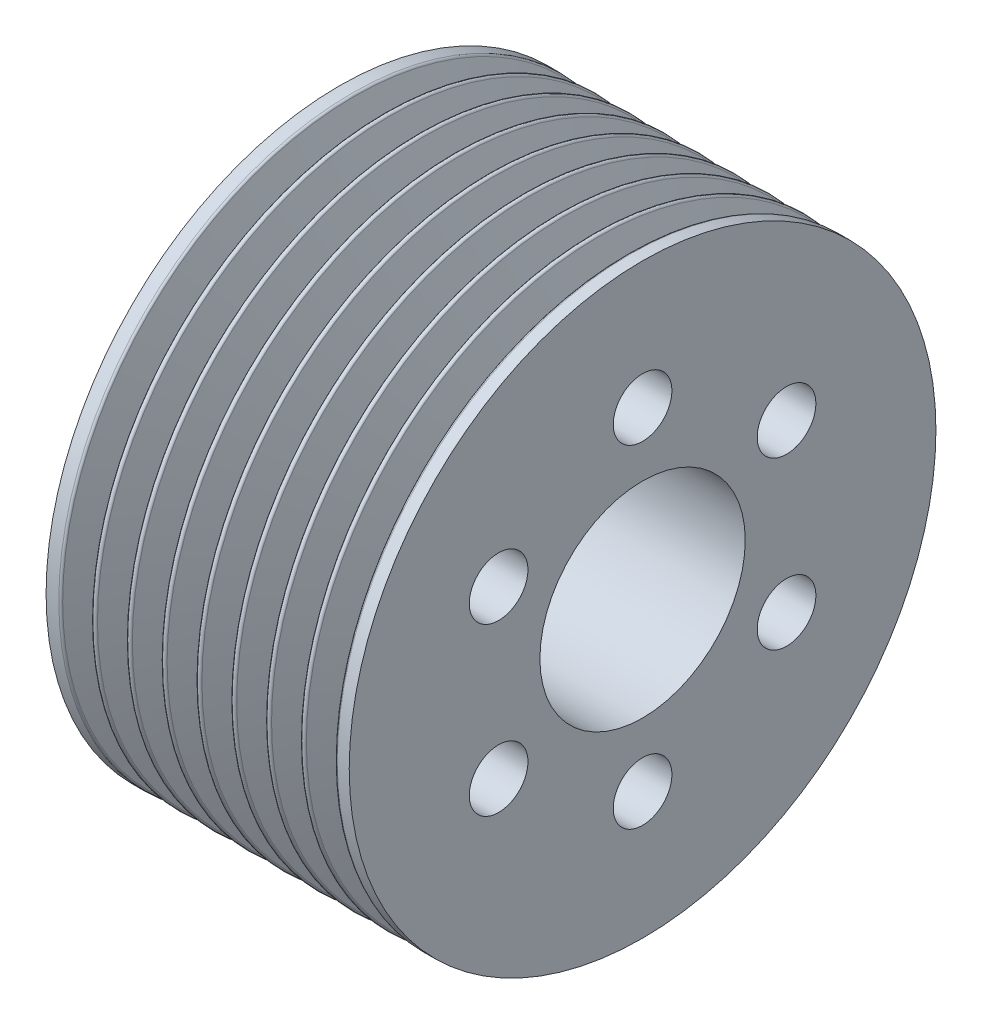
from build123d import *

# Parameters (mm, degrees)
LPATTERN1_COUNT    = 8
LPATTERN1_PITCH    = 3.56
SKETCH3_R          = 3
CUT_EXTRUDE1_DEPTH = 17.5


with BuildPart() as part:
    # Sketch1 → Revolve1 (revolve)
    with BuildSketch(Plane.XY, mode=Mode.PRIVATE) as revolve1_sk:
        Polygon((49, 10.5), (49, 30), (18, 30), (18, 25), (31.5, 25), (31.5, 10.5), align=None)
    revolve(revolve1_sk.sketch.rotate(Axis((0, 0, 0), (1, 0, 0)), 90), axis=Axis((0, 0, 0), (1, 0, 0)))

    # Sketch2 → Cut-Revolve1 (revolve, cut)
    with BuildSketch(Plane.XY, mode=Mode.PRIVATE) as cut_revolve1_sk:
        with BuildLine():
            Line((47.545076845, 29.835505036), (46.281907786, 26.36497657))
            ThreePointArc((46.281907786, 26.36497657), (46, 26.167582613), (45.718092214, 26.36497657))
            Line((45.718092214, 26.36497657), (44.454923155, 29.835505036))
            ThreePointArc((44.454923155, 29.835505036), (44.363394109, 29.954788011), (44.22, 30))
            Line((44.22, 30), (47.78, 30))
            ThreePointArc((47.78, 30), (47.636605891, 29.954788011), (47.545076845, 29.835505036))
        make_face()
    cut_revolve1 = revolve(cut_revolve1_sk.sketch.rotate(Axis((0, 0, 0), (1, 0, 0)), 90), axis=Axis((0, 0, 0), (1, 0, 0)), mode=Mode.SUBTRACT)

    # LPattern1: Cut-Revolve1 ×8
    with Locations(*[(-i * LPATTERN1_PITCH, 0, 0) for i in range(1, LPATTERN1_COUNT)]):
        add(cut_revolve1, mode=Mode.SUBTRACT)

    # Sketch3 → Cut-Extrude1 (cut)
    with BuildSketch(Plane(origin=(49, 0, 0), x_dir=(0, 0, -1), z_dir=(1, 0, 0))):
        with Locations((0, 17)):
            Circle(SKETCH3_R)
        with Locations((14.722431864, 8.5)):
            Circle(SKETCH3_R)
        with Locations((14.722431864, -8.5)):
            Circle(SKETCH3_R)
        with Locations((0, -17)):
            Circle(SKETCH3_R)
        with Locations((-14.722431864, -8.5)):
            Circle(SKETCH3_R)
        with Locations((-14.722431864, 8.5)):
            Circle(SKETCH3_R)
    extrude(amount=-CUT_EXTRUDE1_DEPTH, mode=Mode.SUBTRACT)


solid = part.part
